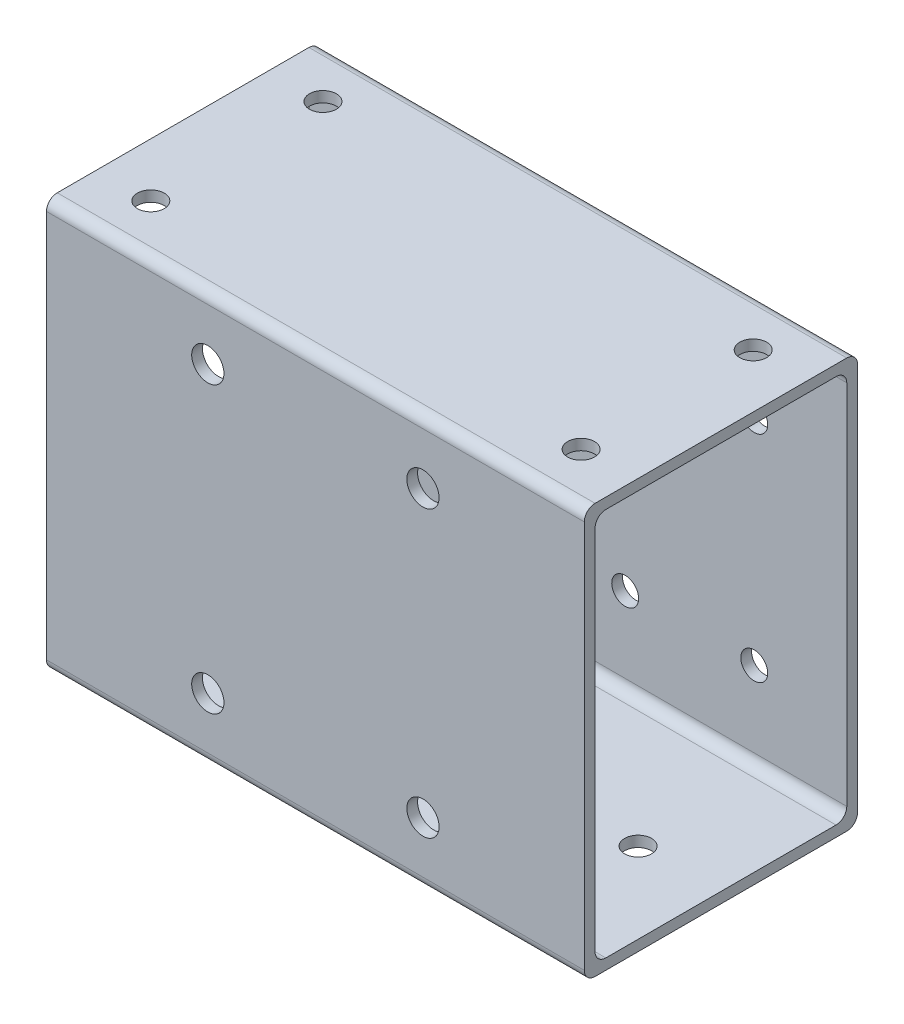
from build123d import *

# Parameters (mm, degrees)
SKETCH1_W             = 50.8
SKETCH1_H             = 76.2
BOSS_EXTRUDE1_DEPTH   = 100
SKETCH2_W             = 46.8
SKETCH2_H             = 72.2
CUT_EXTRUDE1_DEPTH    = 110.985317202
FILLET2_R             = 2
CORTAR_EXTRUIR2_DEPTH = 10
CROQUIS6_R            = 2.5
CORTAR_EXTRUIR6_DEPTH = 10
CROQUIS7_R            = 2.5
CORTAR_EXTRUIR7_DEPTH = 10
CROQUIS8_R            = 2.5
CORTAR_EXTRUIR8_DEPTH = 10


with BuildPart() as part:
    # Sketch1 → Boss-Extrude1 (new body)
    with BuildSketch(Plane(origin=(0, 0, 0), x_dir=(0, 0, -1), z_dir=(1, 0, 0))):
        Rectangle(SKETCH1_W, SKETCH1_H)
    extrude(amount=-BOSS_EXTRUDE1_DEPTH)

    # Sketch2 → Cut-Extrude1 (cut, through all)
    with BuildSketch(Plane(origin=(0, 0, 0), x_dir=(0, 0, -1), z_dir=(1, 0, 0))):
        Rectangle(SKETCH2_W, SKETCH2_H)
    extrude(amount=-CUT_EXTRUDE1_DEPTH, mode=Mode.SUBTRACT)

    # Fillet2
    fillet2_edges = [part.edges().sort_by_distance(p)[0] for p in [
        (-50, -36.1, 23.4),
        (-50, 36.1, 23.4),
        (-50, 36.1, -23.4),
        (-50, -36.1, -23.4),
        (-50, 38.1, 25.4),
        (-50, 38.1, -25.4),
        (-50, -38.1, -25.4),
        (-50, -38.1, 25.4),
    ]]
    fillet(fillet2_edges, radius=FILLET2_R)

    # Croquis2 → Cortar-Extruir2 (cut)
    with BuildSketch(Plane.XY.offset(25.4)):
        with BuildLine():
            ThreePointArc((-27, 26.5), (-30, 29.5), (-33, 26.5))
            Line((-33, 26.5), (-30, 26.5))
            Line((-30, 26.5), (-30, 23.5))
            ThreePointArc((-30, 23.5), (-27.878679656, 24.378679656), (-27, 26.5))
        make_face()
        with BuildLine():
            Line((-30, 26.5), (-33, 26.5))
            ThreePointArc((-33, 26.5), (-32.121320344, 24.378679656), (-30, 23.5))
            Line((-30, 23.5), (-30, 26.5))
        make_face()
        with BuildLine():
            ThreePointArc((-70, 23.5), (-67.878679656, 24.378679656), (-67, 26.5))
            Line((-67, 26.5), (-70, 26.5))
            Line((-70, 26.5), (-70, 23.5))
        make_face()
        with BuildLine():
            Line((-70, 26.5), (-67, 26.5))
            ThreePointArc((-67, 26.5), (-72.121320344, 28.621320344), (-70, 23.5))
            Line((-70, 23.5), (-70, 26.5))
        make_face()
        with BuildLine():
            ThreePointArc((-67, -26.5), (-67.878679656, -24.378679656), (-70, -23.5))
            Line((-70, -23.5), (-70, -26.5))
            Line((-70, -26.5), (-67, -26.5))
        make_face()
        with BuildLine():
            Line((-70, -26.5), (-70, -23.5))
            ThreePointArc((-70, -23.5), (-72.121320344, -28.621320344), (-67, -26.5))
            Line((-67, -26.5), (-70, -26.5))
        make_face()
        with BuildLine():
            ThreePointArc((-27, -26.5), (-27.878679656, -24.378679656), (-30, -23.5))
            Line((-30, -23.5), (-30, -26.5))
            Line((-30, -26.5), (-33, -26.5))
            ThreePointArc((-33, -26.5), (-30, -29.5), (-27, -26.5))
        make_face()
        with BuildLine():
            Line((-30, -26.5), (-30, -23.5))
            ThreePointArc((-30, -23.5), (-32.121320344, -24.378679656), (-33, -26.5))
            Line((-33, -26.5), (-30, -26.5))
        make_face()
    extrude(amount=-CORTAR_EXTRUIR2_DEPTH, mode=Mode.SUBTRACT)

    # Croquis6 → Cortar-Extruir6 (cut)
    with BuildSketch(Plane(origin=(0, 0, -25.4), x_dir=(-1, 0, 0), z_dir=(0, 0, -1))):
        with Locations(Location((17.2, 20, 0), (0, 0, 90))):
            Circle(CROQUIS6_R)
        with Locations(Location((17.2, -20, 0), (0, 0, 90))):
            Circle(CROQUIS6_R)
        with Locations(Location((41.2, -20, 0), (0, 0, 90))):
            Circle(CROQUIS6_R)
        with Locations(Location((41.2, 20, 0), (0, 0, 90))):
            Circle(CROQUIS6_R)
    extrude(amount=-CORTAR_EXTRUIR6_DEPTH, mode=Mode.SUBTRACT)

    # Croquis7 → Cortar-Extruir7 (cut)
    with BuildSketch(Plane.XZ.offset(38.1)):
        with Locations(Location((-15, 0.4, 0), (0, 0, 270))):
            Circle(CROQUIS7_R)
        with Locations(Location((-80, 0.4, 0), (0, 0, 270))):
            Circle(CROQUIS7_R)
    extrude(amount=-CORTAR_EXTRUIR7_DEPTH, mode=Mode.SUBTRACT)

    # Croquis8 → Cortar-Extruir8 (cut)
    with BuildSketch(Plane(origin=(0, 38.1, 0), x_dir=(1, 0, 0), z_dir=(0, 1, 0))):
        with Locations(Location((-90, 16, 0), (0, 0, 270))):
            Circle(CROQUIS8_R)
        with Locations(Location((-10, 16, 0), (0, 0, 270))):
            Circle(CROQUIS8_R)
        with Locations(Location((-90, -16, 0), (0, 0, 270))):
            Circle(CROQUIS8_R)
        with Locations(Location((-10, -16, 0), (0, 0, 270))):
            Circle(CROQUIS8_R)
    extrude(amount=-CORTAR_EXTRUIR8_DEPTH, mode=Mode.SUBTRACT)


solid = part.part
